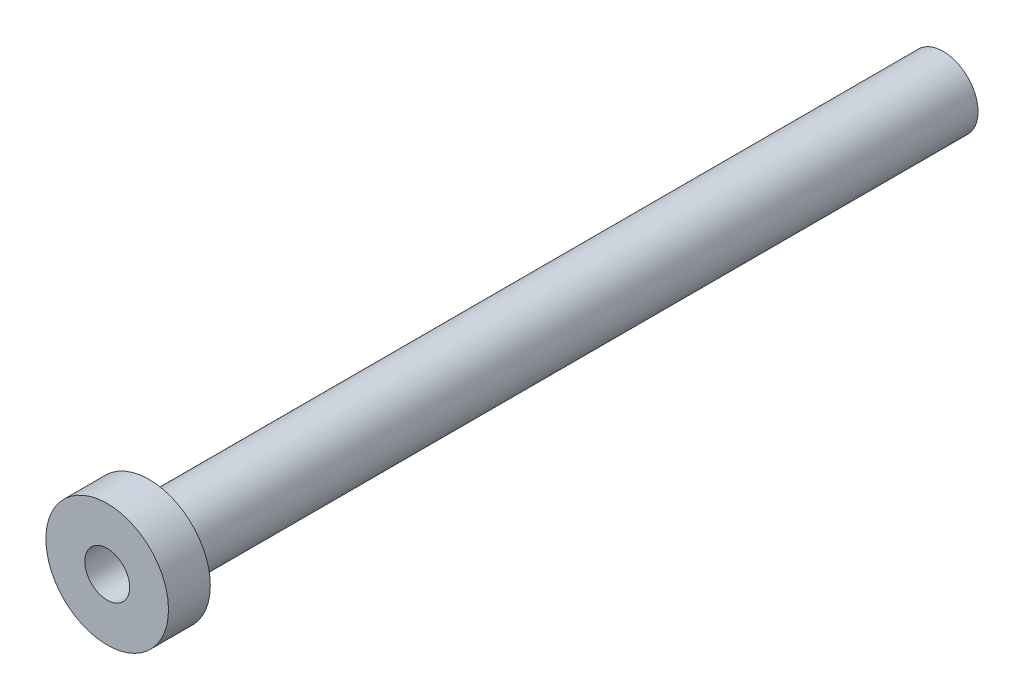
from build123d import *

# Parameters (mm, degrees)
SKETCH1_R           = 22
BOSS_EXTRUDE1_DEPTH = 15
SKETCH2_R           = 17.75
SKETCH2_R_2         = 12.5
CUT_EXTRUDE1_DEPTH  = 10
SKETCH3_R           = 8.05
CUT_EXTRUDE2_DEPTH  = 35.539832078
SKETCH4_R           = 12.5
SKETCH4_R_2         = 8.05
BOSS_EXTRUDE2_DEPTH = 285


with BuildPart() as part:
    # Sketch1 → Boss-Extrude1 (new body)
    with BuildSketch(Plane.XY):
        Circle(SKETCH1_R)
    extrude(amount=BOSS_EXTRUDE1_DEPTH)

    # Sketch2 → Cut-Extrude1 (cut)
    with BuildSketch(Plane(origin=(0, 0, 0), x_dir=(-1, 0, 0), z_dir=(0, 0, -1))):
        Circle(SKETCH2_R)
        Circle(SKETCH2_R_2, mode=Mode.SUBTRACT)
    extrude(amount=-CUT_EXTRUDE1_DEPTH, mode=Mode.SUBTRACT)

    # Sketch3 → Cut-Extrude2 (cut, through all)
    with BuildSketch(Plane.XY.offset(15)):
        Circle(SKETCH3_R)
    extrude(amount=-CUT_EXTRUDE2_DEPTH, mode=Mode.SUBTRACT)

    # Sketch4 → Boss-Extrude2 (add)
    with BuildSketch(Plane(origin=(0, 0, 0), x_dir=(-1, 0, 0), z_dir=(0, 0, -1))):
        Circle(SKETCH4_R)
        with Locations(Location((0, 0, 0), (0, 0, 180))):
            Circle(SKETCH4_R_2, mode=Mode.SUBTRACT)
    extrude(amount=BOSS_EXTRUDE2_DEPTH)


solid = part.part
